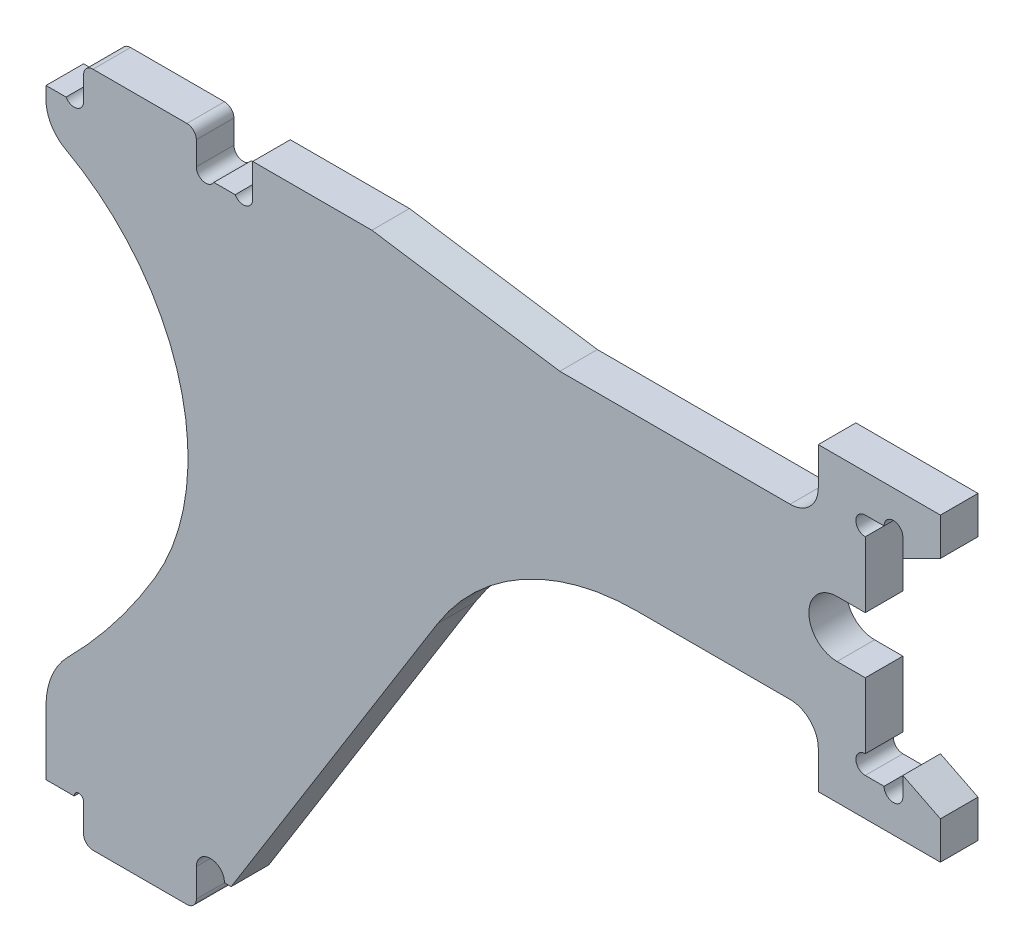
from build123d import *

# Parameters (mm, degrees)
BOSS_EXTRUDE1_DEPTH = 2
FILLET1_R           = 1.5


with BuildPart() as part:
    # Sketch4 → Boss-Extrude1 (new body)
    with BuildSketch(Plane.XY):
        with BuildLine():
            Line((-13.050908111, 16), (-6.706499702, 16))
            Line((-6.706499702, 16), (3.293500298, 14.5))
            Line((3.293500298, 14.5), (17.050908111, 14.5))
            Line((17.050908111, 14.5), (17.050908111, 18))
            Line((17.050908111, 18), (23.550908111, 18))
            Line((23.550908111, 18), (23.550908111, 16))
            Line((23.550908111, 16), (21.550908111, 15))
            Line((21.550908111, 15), (21.550908111, 16))
            ThreePointArc((21.550908111, 16), (21.050908111, 16.5), (20.550908111, 16))
            Line((20.550908111, 16), (19.550908111, 16))
            ThreePointArc((19.550908111, 16), (19.050908111, 15.5), (19.550908111, 15))
            Line((19.550908111, 15), (19.550908111, 11.5))
            Line((19.550908111, 11.5), (18.050908111, 11.5))
            ThreePointArc((18.050908111, 11.5), (16.550908111, 10), (18.050908111, 8.5))
            Line((18.050908111, 8.5), (19.550908111, 8.5))
            Line((19.550908111, 8.5), (19.550908111, 5))
            ThreePointArc((19.550908111, 5), (19.050908111, 4.5), (19.550908111, 4))
            Line((19.550908111, 4), (20.550908111, 4))
            ThreePointArc((20.550908111, 4), (21.050908111, 3.5), (21.550908111, 4))
            Line((21.550908111, 4), (21.550908111, 5))
            Line((21.550908111, 5), (23.550908111, 4))
            Line((23.550908111, 4), (23.550908111, 2))
            Line((23.550908111, 2), (17.050908111, 2))
            Line((17.050908111, 2), (17.050908111, 5.5))
            Line((17.050908111, 5.5), (7.394672813, 5.5))
            ThreePointArc((7.394672813, 5.5), (1.329569341, 3.929982611), (-3.211963264, -0.38567682))
            Line((-3.211963264, -0.38567682), (-14.196296588, -18))
            Line((-14.196296588, -18), (-14.550908111, -18))
            ThreePointArc((-14.550908111, -18), (-15.300908111, -17.25), (-16.050908111, -18))
            Line((-16.050908111, -18), (-16.050908111, -19.5))
            ThreePointArc((-16.050908111, -19.5), (-16.197354721, -19.853553391), (-16.550908111, -20))
            Line((-16.550908111, -20), (-21.550908111, -20))
            ThreePointArc((-21.550908111, -20), (-21.904461502, -19.853553391), (-22.050908111, -19.5))
            Line((-22.050908111, -19.5), (-22.050908111, -18))
            ThreePointArc((-22.050908111, -18), (-22.300908111, -17.75), (-22.550908111, -18))
            Line((-22.550908111, -18), (-24.050908111, -18))
            Line((-24.050908111, -18), (-24.050908111, -14.588152482))
            ThreePointArc((-24.050908111, -14.588152482), (-23.749083006, -13.063848559), (-22.889156888, -11.769581233))
            ThreePointArc((-22.889156888, -11.769581233), (-20.39098235, -8.926642121), (-18.257237664, -5.800892224))
            ThreePointArc((-18.257237664, -5.800892224), (-16.93384188, 3.900322575), (-23.008225895, 11.579307131))
            ThreePointArc((-23.008225895, 11.579307131), (-23.770593485, 12.314190907), (-24.050908111, 13.335309027))
            Line((-24.050908111, 13.335309027), (-24.050908111, 14))
            Line((-24.050908111, 14), (-22.983920813, 14))
            ThreePointArc((-22.983920813, 14), (-22.421498589, 13.767037087), (-22.050908111, 14.25))
            Line((-22.050908111, 14.25), (-22.050908111, 15.5))
            ThreePointArc((-22.050908111, 15.5), (-21.904461502, 15.853553391), (-21.550908111, 16))
            Line((-21.550908111, 16), (-16.550908111, 16))
            ThreePointArc((-16.550908111, 16), (-16.197354721, 15.853553391), (-16.050908111, 15.5))
            Line((-16.050908111, 15.5), (-16.050908111, 14.25))
            ThreePointArc((-16.050908111, 14.25), (-15.680317634, 13.767037087), (-15.11789541, 14))
            Line((-15.11789541, 14), (-13.983920813, 14))
            ThreePointArc((-13.983920813, 14), (-13.421498589, 13.767037087), (-13.050908111, 14.25))
            Line((-13.050908111, 14.25), (-13.050908111, 16))
        make_face()
    extrude(amount=BOSS_EXTRUDE1_DEPTH)

    # Fillet1
    fillet1_edges = [part.edges().sort_by_distance(p)[0] for p in [
        (17.050908111, 14.5, 1),
        (17.050908111, 5.5, 1),
    ]]
    fillet(fillet1_edges, radius=FILLET1_R)


solid = part.part
